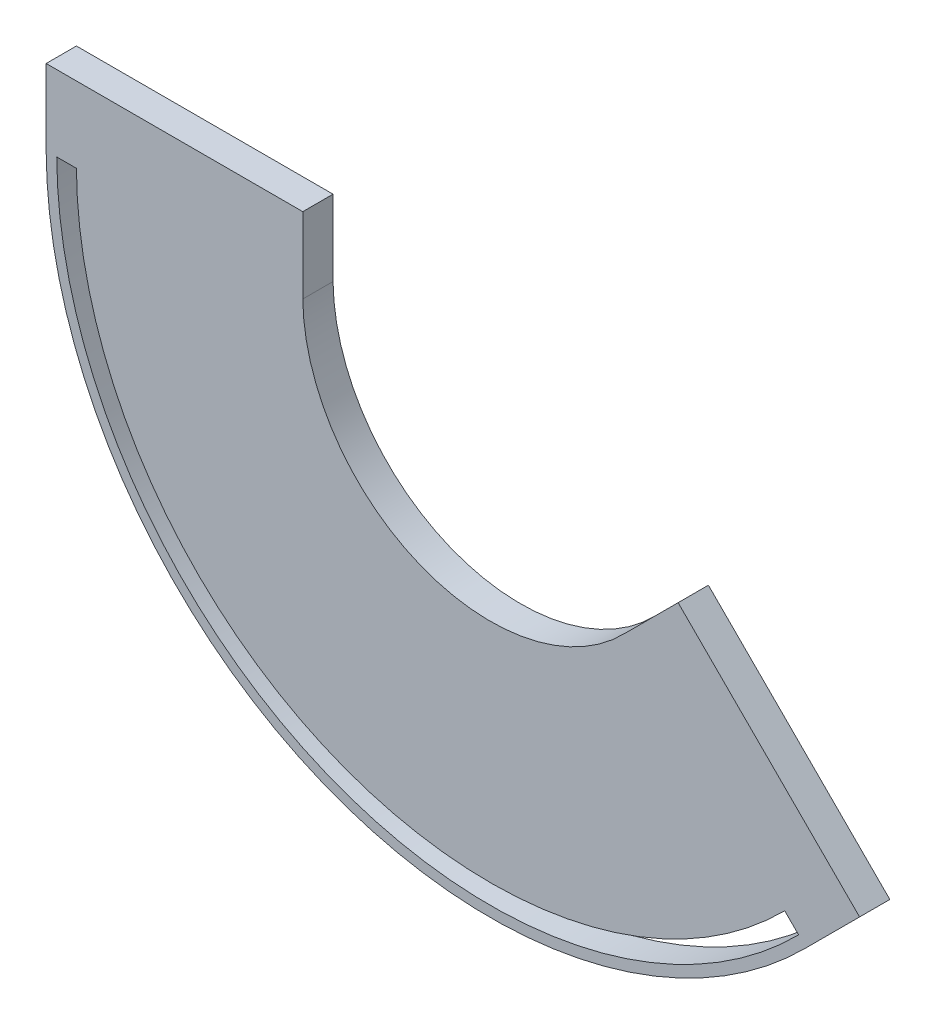
from build123d import *

# Parameters (mm, degrees)
BOSS_EXTRUDE3_DEPTH = 5.08
CUT_EXTRUDE1_DEPTH  = 106.587982078


with BuildPart() as part:
    # Sketch2 → Boss-Extrude3 (new body)
    with BuildSketch(Plane.XY):
        with BuildLine():
            Line((22.537725188, -22.001112684), (31.517981309, -13.020856563))
            Line((31.517981309, -13.020856563), (61.981075074, -43.483950327))
            Line((61.981075074, -43.483950327), (53.000818953, -52.464206448))
            ThreePointArc((53.000818953, -52.464206448), (-28.188071212, -69.043554437), (-74.575034639, -0.379442341))
            Line((-74.575034639, -0.379442341), (-74.575034639, 12.320557659))
            Line((-74.575034639, 12.320557659), (-31.493714286, 12.320557659))
            Line((-31.493714286, 12.320557659), (-31.493714286, -0.379442341))
            ThreePointArc((-31.493714286, -0.379442341), (-11.701563668, -29.241604329), (22.537725188, -22.001112684))
        make_face()
    extrude(amount=BOSS_EXTRUDE3_DEPTH)

    # Sketch3 → Cut-Extrude1 (cut, through all)
    with BuildSketch(Plane.XY.offset(5.08)):
        with BuildLine():
            Line((-72.797011063, -0.379442341), (-69.494964077, -0.379442341))
            ThreePointArc((-69.494964077, -0.379442341), (-26.244012372, -64.35018122), (49.408666609, -48.872054105))
            Line((49.408666609, -48.872054105), (51.743566425, -51.20695392))
            ThreePointArc((51.743566425, -51.20695392), (-27.507651047, -67.400874846), (-72.797011063, -0.379442341))
        make_face()
    extrude(amount=-CUT_EXTRUDE1_DEPTH, mode=Mode.SUBTRACT)


solid = part.part
